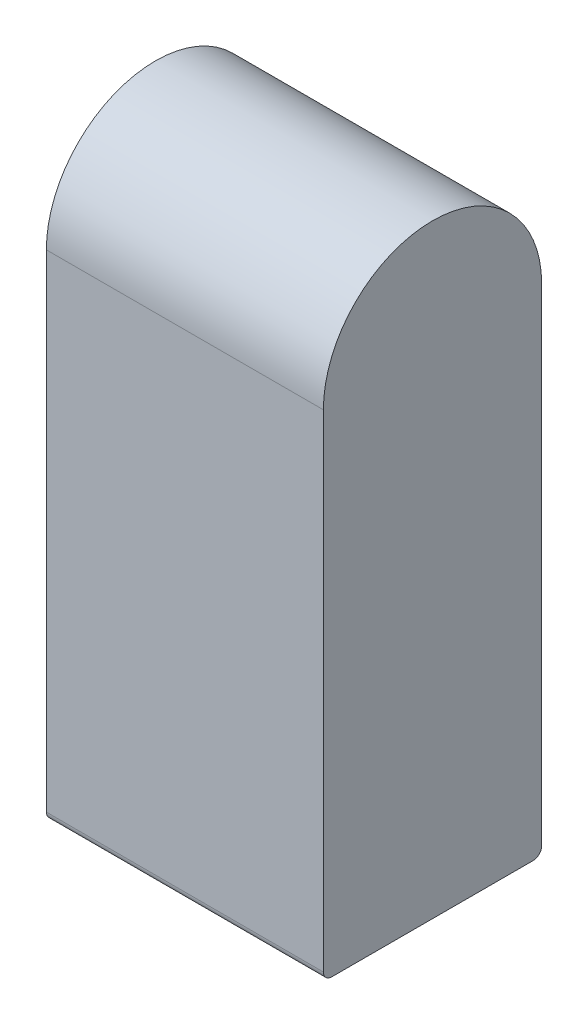
from build123d import *

# Parameters (mm, degrees)
SALIENTE_EXTRUIR4_DEPTH = 16.5


with BuildPart() as part:
    # Croquis1 → Saliente-Extruir4 (new, symmetric)
    with BuildSketch(Plane(origin=(0, 0, 0), x_dir=(0, 0, -1), z_dir=(1, 0, 0))):
        with BuildLine():
            Line((-12, -30), (12, -30))
            ThreePointArc((12, -30), (12.707106781, -29.707106781), (13, -29))
            Line((13, -29), (13, 29))
            ThreePointArc((13, 29), (0, 42), (-13, 29))
            Line((-13, 29), (-13, -29))
            ThreePointArc((-13, -29), (-12.707106781, -29.707106781), (-12, -30))
        make_face()
    extrude(amount=SALIENTE_EXTRUIR4_DEPTH, both=True)


solid = part.part
